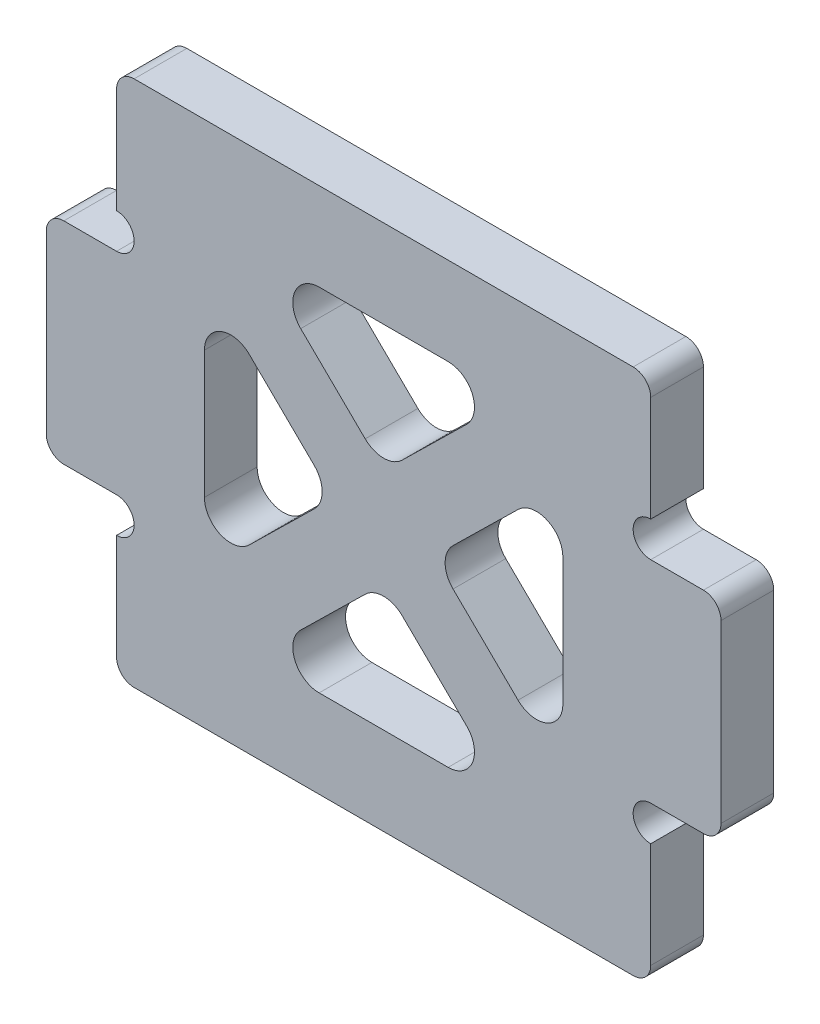
from build123d import *

# Parameters (mm, degrees)
EXTRUDE_1_DEPTH     = 3
SKETCH_2_R          = 1
CUT_EXTRUDE_1_DEPTH = 25.548727055
SKETCH_3_W          = 20.4
SKETCH_3_H          = 20
CUT_EXTRUDE_2_DEPTH = 25.548727055
EXTRUDE_1_2_DEPTH   = 3
FILLET_1_R          = 1
FILLET_2_R          = 1.5


with BuildPart() as part:
    # 草图1 → Extrude 1 (new body)
    with BuildSketch(Plane.XY):
        Polygon((15.2, -15), (-15.2, -15), (-15.2, -6), (-19.2, -6), (-19.2, 6), (-15.2, 6), (-15.2, 15), (15.2, 15), (15.2, 6), (19.2, 6), (19.2, -6), (15.2, -6), align=None)
    extrude(amount=EXTRUDE_1_DEPTH)

    # 草图2 → 切除-拉伸1 (cut, through all)
    with BuildSketch(Plane.XY.offset(3)):
        with Locations((-15.2, 7)):
            Circle(SKETCH_2_R)
        with Locations((-15.2, -7)):
            Circle(SKETCH_2_R)
        with Locations((15.2, -7)):
            Circle(SKETCH_2_R)
        with Locations((15.2, 7)):
            Circle(SKETCH_2_R)
    extrude(amount=-CUT_EXTRUDE_1_DEPTH, mode=Mode.SUBTRACT)

    # 草图3 → 切除-拉伸2 (cut, through all)
    with BuildSketch(Plane.XY.offset(3)):
        Rectangle(SKETCH_3_W, SKETCH_3_H)
    extrude(amount=-CUT_EXTRUDE_2_DEPTH, mode=Mode.SUBTRACT)

    # 草图4 → Extrude 1 2 (add)
    with BuildSketch(Plane.XY.offset(3)):
        Polygon((-11.600142822, 8.571854322), (8.799857178, -11.428145678), (11.600142822, -8.571854322), (-8.799857178, 11.428145678), align=None)
        Polygon((-8.799857178, -11.428145678), (11.600142822, 8.571854322), (8.799857178, 11.428145678), (-11.600142822, -8.571854322), align=None)
    extrude(amount=-EXTRUDE_1_2_DEPTH)

    # 圆角1
    fillet_1_edges = [part.edges().sort_by_distance(p)[0] for p in [
        (-15.2, 15, 1.5),
        (15.2, 15, 1.5),
        (19.2, 6, 1.5),
        (19.2, -6, 1.5),
        (15.2, -15, 1.5),
        (-15.2, -15, 1.5),
        (-19.2, -6, 1.5),
        (-19.2, 6, 1.5),
    ]]
    fillet(fillet_1_edges, radius=FILLET_1_R)

    # 圆角2
    fillet_2_edges = [part.edges().sort_by_distance(p)[0] for p in [
        (-2.856851414, 0, 1.5),
        (0, 2.800834719, 1.5),
        (2.856851414, 0, 1.5),
        (0, -2.800834719, 1.5),
        (-7.343148586, -10, 1.5),
        (7.343148586, -10, 1.5),
        (10.2, 7.199165281, 1.5),
        (10.2, -7.199165281, 1.5),
        (7.343148586, 10, 1.5),
        (-7.343148586, 10, 1.5),
        (-10.2, -7.199165281, 1.5),
        (-10.2, 7.199165281, 1.5),
    ]]
    fillet(fillet_2_edges, radius=FILLET_2_R)


solid = part.part
